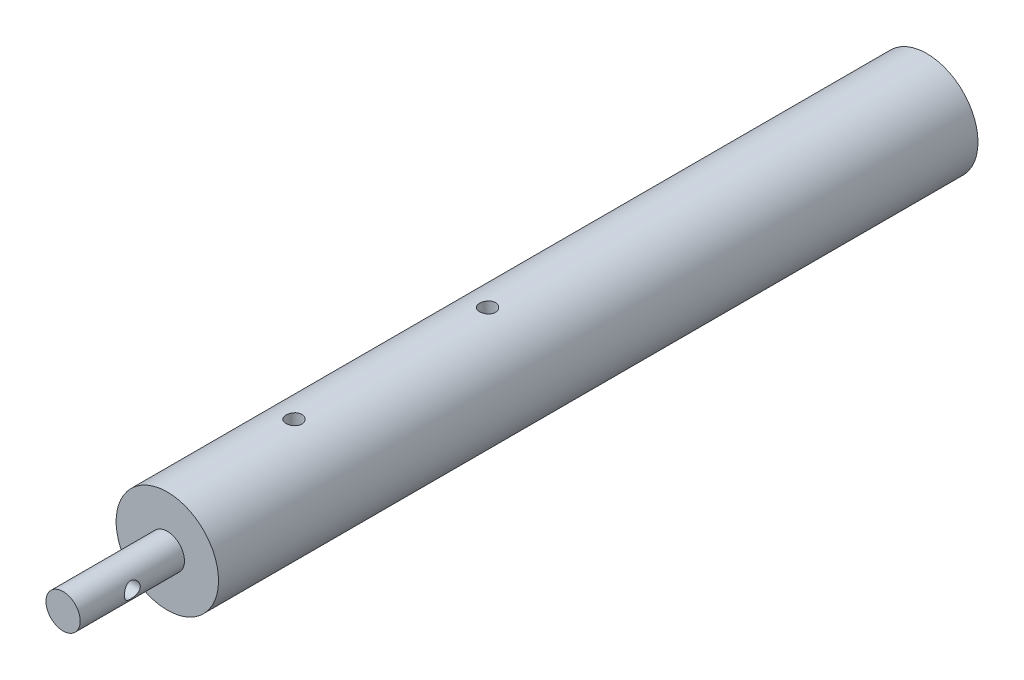
from build123d import *

# Parameters (mm, degrees)
SKETCH1_R             = 8.73125
BOSS_EXTRUDE1_DEPTH   = 129.54
SKETCH2_R             = 2.921
BOSS_EXTRUDE2_DEPTH   = 17.78
F_6_32_TAPPED_HOLE1_D = 2.7051
F_6_32_TAPPED_HOLE2_D = 2.7051


with BuildPart() as part:
    # Sketch1 → Boss-Extrude1 (new body)
    with BuildSketch(Plane.XY):
        Circle(SKETCH1_R)
    extrude(amount=BOSS_EXTRUDE1_DEPTH)

    # Sketch2 → Boss-Extrude2 (add)
    with BuildSketch(Plane.XY.offset(129.54)):
        Circle(SKETCH2_R)
    extrude(amount=BOSS_EXTRUDE2_DEPTH)

    # #6-32 Tapped Hole1 (through all)
    with Locations(Plane(origin=(0, 8.73125, 0), x_dir=(1, 0, 0), z_dir=(0, 1, 0))):
        with Locations((0, -74.93), (0, -107.95)):
            Hole(F_6_32_TAPPED_HOLE1_D / 2)

    # #6-32 Tapped Hole2 (through all)
    with Locations(Plane(origin=(2.921, 0, 0), x_dir=(0, 0, -1), z_dir=(1, 0, 0))):
        with Locations((-138.43, 0)):
            Hole(F_6_32_TAPPED_HOLE2_D / 2)


solid = part.part
